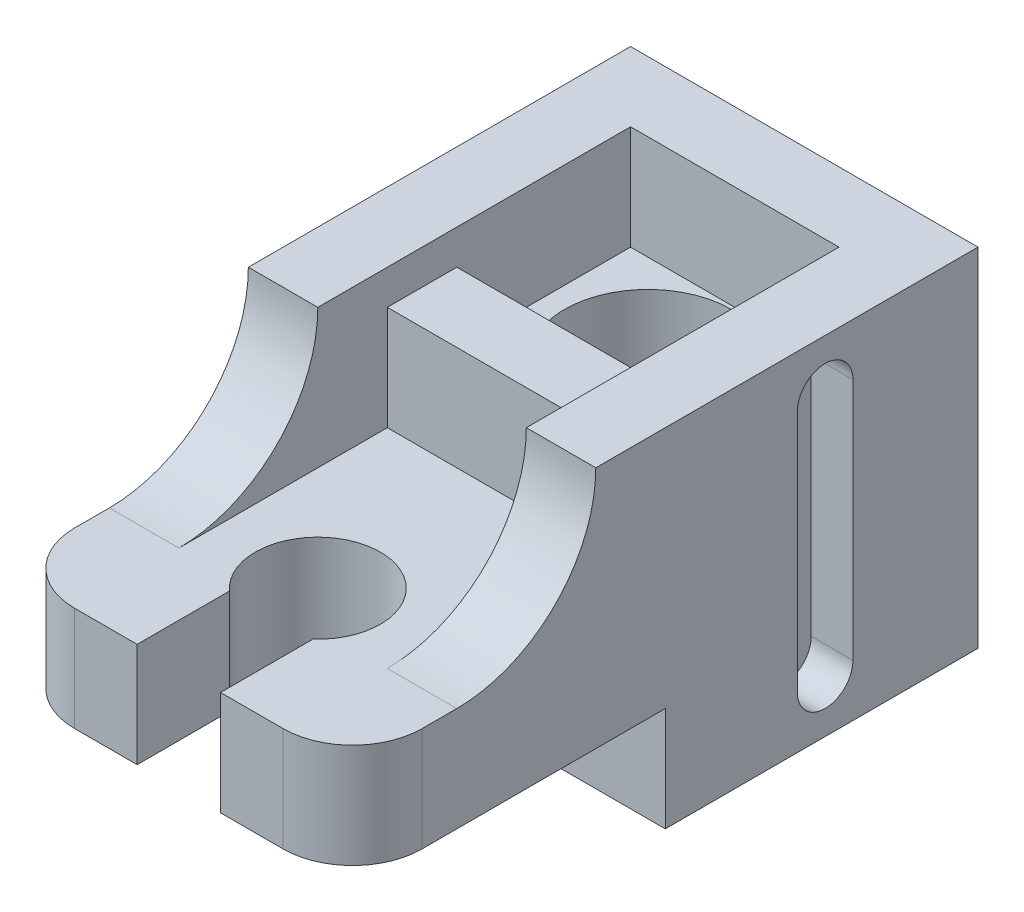
from build123d import *

# Parameters (mm, degrees)
BOSS_EXTRUDE3_DEPTH = 25
CUT_EXTRUDE3_DEPTH  = 15
SKETCH9_R           = 12
SKETCH9_R_2         = 9
CUT_EXTRUDE4_DEPTH  = 72.763500472
CUT_EXTRUDE5_DEPTH  = 6
FILLET2_R           = 10


with BuildPart() as part:
    # Sketch6 → Boss-Extrude3 (new, symmetric)
    with BuildSketch(Plane(origin=(0, 0, 0), x_dir=(0, 0, -1), z_dir=(1, 0, 0))):
        with BuildLine():
            Line((0, 0), (45, 0))
            Line((45, 0), (45, 50))
            Line((45, 50), (-10, 50))
            ThreePointArc((-10, 50), (-15.857864376, 35.857864376), (-30, 30))
            Line((-30, 30), (-45, 30))
            Line((-45, 30), (-45, 15))
            Line((-45, 15), (0, 15))
            Line((0, 15), (0, 0))
        make_face()
    extrude(amount=BOSS_EXTRUDE3_DEPTH, both=True)

    # Sketch8 → Cut-Extrude3 (cut, symmetric)
    with BuildSketch(Plane(origin=(0, 0, 0), x_dir=(0, 0, -1), z_dir=(1, 0, 0))):
        with BuildLine():
            Line((35, 50), (35, 35))
            Line((35, 35), (10, 35))
            Line((10, 35), (10, 45))
            Line((10, 45), (0, 45))
            Line((0, 45), (0, 30))
            Line((0, 30), (-30, 30))
            ThreePointArc((-30, 30), (-15.857864376, 35.857864376), (-10, 50))
            Line((-10, 50), (35, 50))
        make_face()
    extrude(amount=CUT_EXTRUDE3_DEPTH, both=True, mode=Mode.SUBTRACT)

    # Sketch9 → Cut-Extrude4 (cut, through all)
    with BuildSketch(Plane(origin=(0, 0, 0), x_dir=(1, 0, 0), z_dir=(0, 1, 0))):
        with Locations(Location((0, 22.5, 0), (0, 0, 90))):
            Circle(SKETCH9_R)
        with Locations((0, -25)):
            Circle(SKETCH9_R_2)
        with BuildLine():
            ThreePointArc((6, -31.708203932), (0, -34), (-6, -31.708203932))
            Line((-6, -31.708203932), (-6, -45))
            Line((-6, -45), (6, -45))
            Line((6, -45), (6, -31.708203932))
        make_face()
    extrude(amount=CUT_EXTRUDE4_DEPTH, mode=Mode.SUBTRACT)

    # Sketch14 → Cut-Extrude5 (cut)
    with BuildSketch(Plane(origin=(25, 0, 0), x_dir=(0, 0, -1), z_dir=(1, 0, 0))):
        with BuildLine():
            Line((27, 42.5), (27, 7.5))
            ThreePointArc((27, 7.5), (23, 3.5), (19, 7.5))
            Line((19, 7.5), (19, 42.5))
            ThreePointArc((19, 42.5), (23, 46.5), (27, 42.5))
        make_face()
    cut_extrude5 = extrude(amount=-CUT_EXTRUDE5_DEPTH, mode=Mode.SUBTRACT)

    # Mirror1: Cut-Extrude5 across plane
    add(cut_extrude5.mirror(Plane(origin=(0, 0, 0), x_dir=(0, 0, 1), z_dir=(1, 0, 0))), mode=Mode.SUBTRACT)

    # Fillet2
    fillet2_edges = [part.edges().sort_by_distance(p)[0] for p in [
        (25, 22.5, 45),
        (-25, 22.5, 45),
    ]]
    fillet(fillet2_edges, radius=FILLET2_R)


solid = part.part
